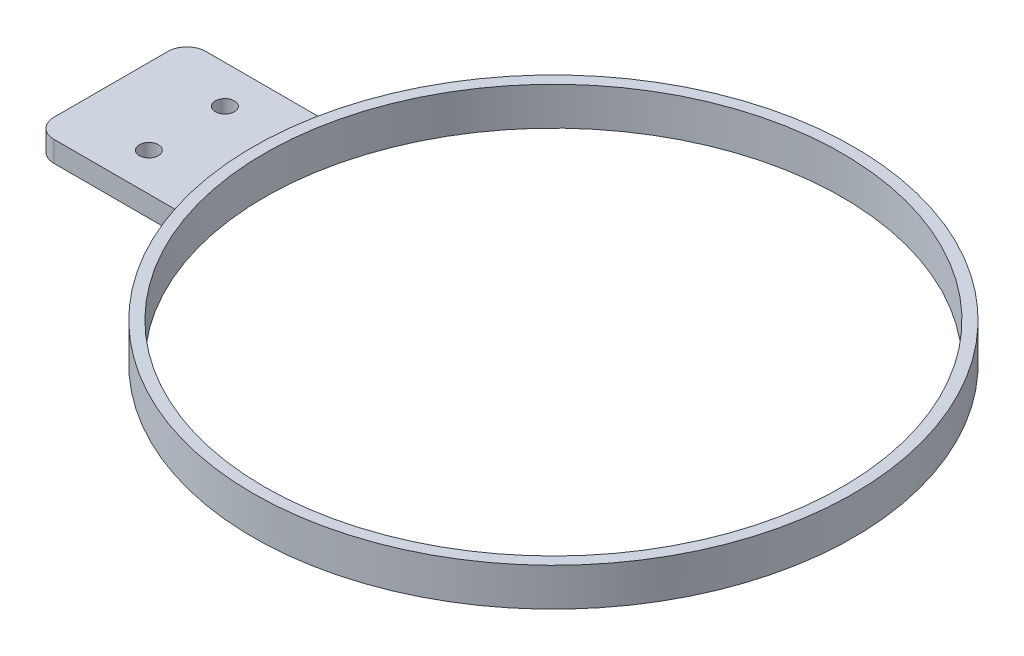
from build123d import *

# Parameters (mm, degrees)
CROQUIS1_R              = 79
CROQUIS1_R_2            = 76
SALIENTE_EXTRUIR1_DEPTH = 10
CROQUIS2_R              = 2.499891185
CROQUIS2_R_2            = 2.5
SALIENTE_EXTRUIR2_DEPTH = 5.5


with BuildPart() as part:
    # Croquis1 → Saliente-Extruir1 (new body)
    with BuildSketch(Plane(origin=(0, 0, 0), x_dir=(1, 0, 0), z_dir=(0, 1, 0))):
        with Locations(Location((0, 0, 0), (0, 0, 270))):
            Circle(CROQUIS1_R)
        with Locations(Location((0, 0, 0), (0, 0, 270))):
            Circle(CROQUIS1_R_2, mode=Mode.SUBTRACT)
    extrude(amount=SALIENTE_EXTRUIR1_DEPTH)

    # Croquis2 → Saliente-Extruir2 (add)
    with BuildSketch(Plane(origin=(0, 0, 0), x_dir=(1, 0, 0), z_dir=(0, 1, 0))):
        with BuildLine():
            Line((-76.426435217, 20), (-111.426435217, 20))
            ThreePointArc((-111.426435217, 20), (-114.961969123, 18.535533906), (-116.426435217, 15))
            Line((-116.426435217, 15), (-116.426435217, -15))
            ThreePointArc((-116.426435217, -15), (-114.961969123, -18.535533906), (-111.426435217, -20))
            Line((-111.426435217, -20), (-76.426435217, -20))
            ThreePointArc((-76.426435217, -20), (-79, 0), (-76.426435217, 20))
        make_face()
        with Locations(Location((-96.426435217, 10, 0), (0, 0, 270))):
            Circle(CROQUIS2_R, mode=Mode.SUBTRACT)
        with Locations(Location((-96.426435217, -10, 0), (0, 0, 270))):
            Circle(CROQUIS2_R_2, mode=Mode.SUBTRACT)
    extrude(amount=SALIENTE_EXTRUIR2_DEPTH)


solid = part.part
